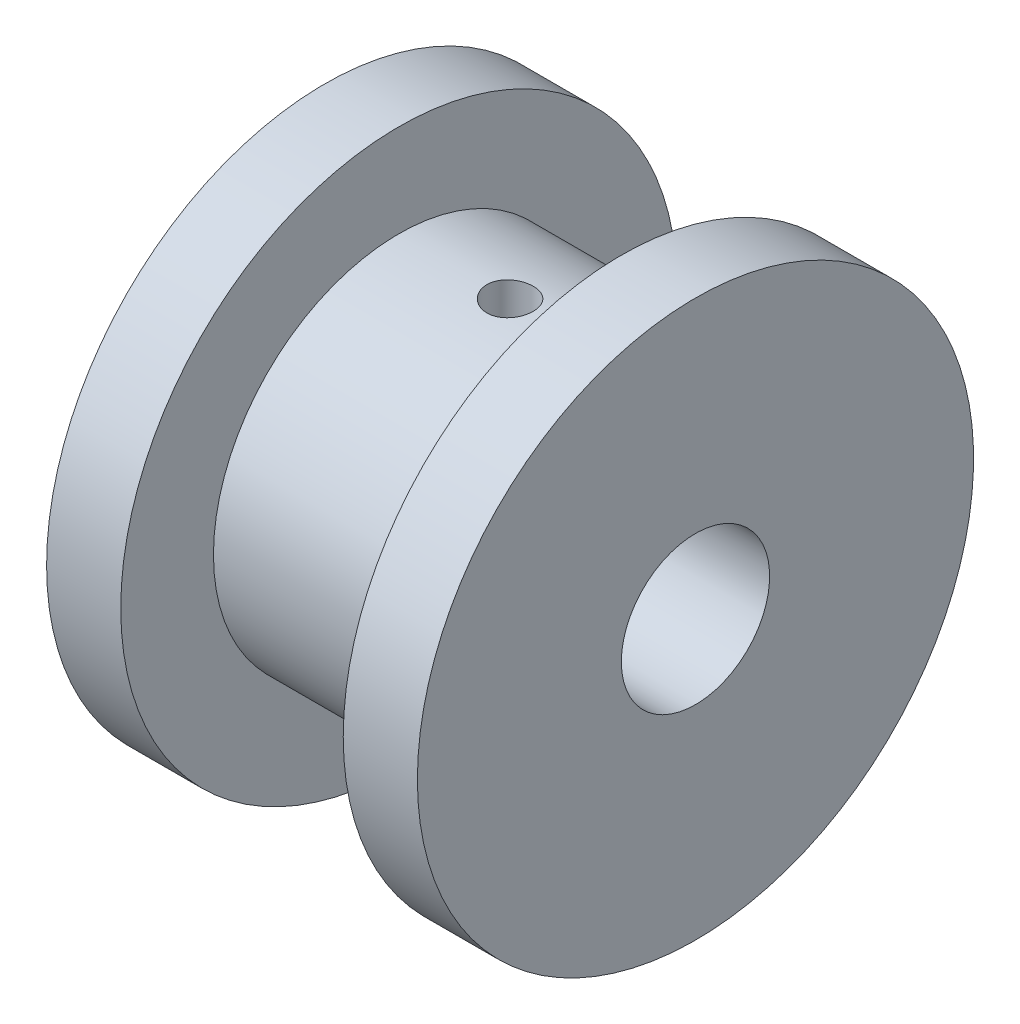
from build123d import *

# Parameters (mm, degrees)
M3_TAPPED_HOLE1_REACH  = 32.822
M3_TAPPED_HOLE1_BORE_R = 1.25


with BuildPart() as part:
    # Sketch1 → Revolve1 (revolve)
    with BuildSketch(Plane(origin=(0, 0, 0), x_dir=(1, 0, 0), z_dir=(0, 1, 0)), mode=Mode.PRIVATE) as revolve1_sk:
        Polygon((0, 4), (20, 4), (20, 15), (16, 15), (16, 10), (4, 10), (4, 15), (0, 15), align=None)
    revolve(revolve1_sk.sketch.rotate(Axis((0, 0, 0), (1, 0, 0)), 180), axis=Axis((0, 0, 0), (1, 0, 0)))

    # M3 Tapped Hole1 bore (on position points) → M3 Tapped Hole1 (cut, up to next)
    with BuildSketch(Plane(origin=(10, 10, 0), x_dir=(0, 0, 1), z_dir=(0, 1, 0)), mode=Mode.PRIVATE) as m3_tapped_hole1_sk1:
        Circle(M3_TAPPED_HOLE1_BORE_R)
    m3_tapped_hole1_tool1 = extrude(m3_tapped_hole1_sk1.sketch, amount=-M3_TAPPED_HOLE1_REACH, mode=Mode.PRIVATE) & part.part
    add(m3_tapped_hole1_tool1.solids().sort_by_distance((10, 10, 0))[0], mode=Mode.SUBTRACT)


solid = part.part
